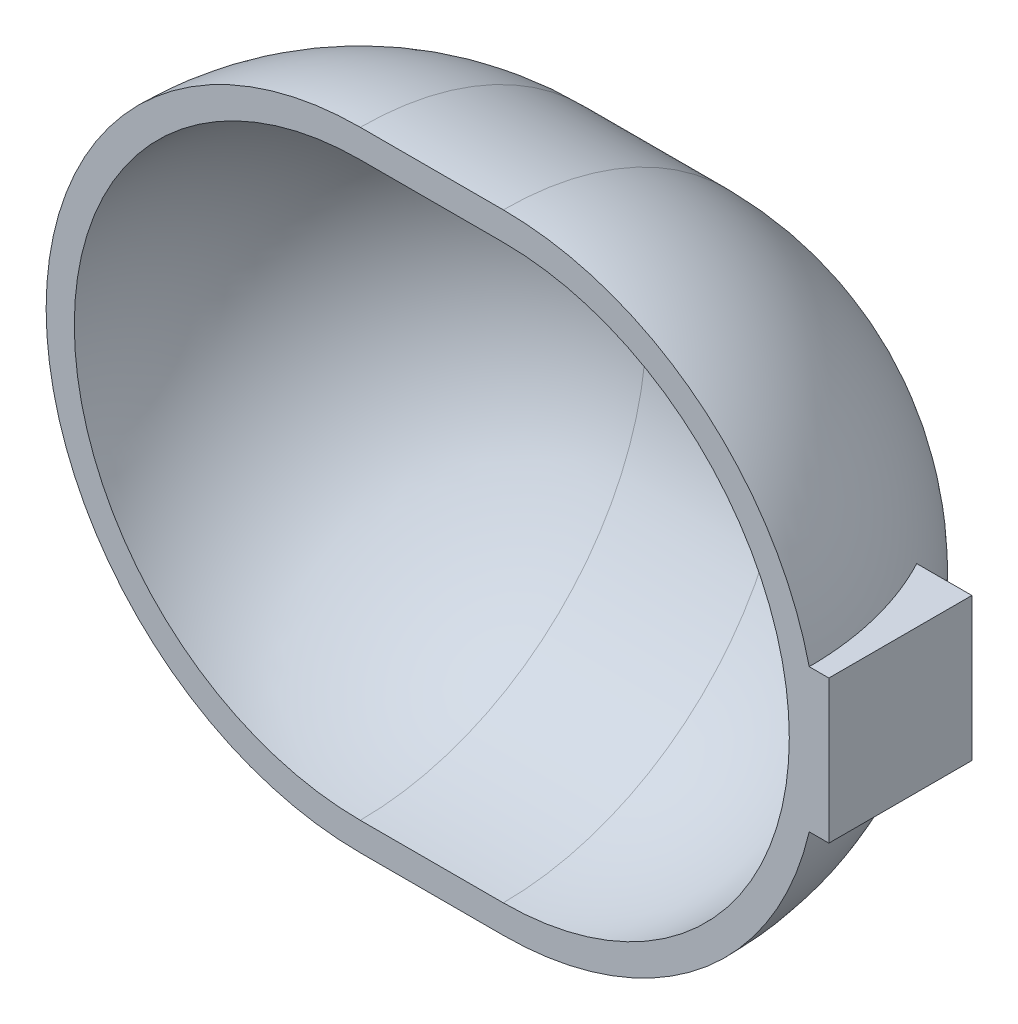
from build123d import *

# Parameters (mm, degrees)
REVOLVE1_ANGLE           = 180
SHELL1_T                 = -50
BOSS_EXTRUDE2_REACH      = 1600.609
BOSS_EXTRUDE2_END_RADIUS = 558
SKETCH5_W                = 254
SKETCH5_H                = 254


with BuildPart() as part:
    # Sketch2 → Revolve1 (revolve)
    with BuildSketch(Plane.XY):
        with BuildLine():
            Line((-279, 0), (279, 0))
            Line((279, 0), (533, 0))
            Line((533, 0), (1091, 0))
            ThreePointArc((1091, 0), (927.565583902, -394.565583902), (533, -558))
            Line((533, -558), (279, -558))
            ThreePointArc((279, -558), (-115.565583902, -394.565583902), (-279, 0))
        make_face()
    revolve(axis=Axis((533, 0, 0), (1, 0, 0)), revolution_arc=REVOLVE1_ANGLE)

    # Shell1
    shell1_openings = [part.faces().sort_by_distance(p)[0] for p in [
        (406, 0, 0),
    ]]
    offset(amount=SHELL1_T, openings=shell1_openings)

    # Boss-Extrude2: up to this sphere (the profile starts outside it)
    boss_extrude2_end = Location((533, 0, 0)) * Sphere(BOSS_EXTRUDE2_END_RADIUS, mode=Mode.PRIVATE)
    # Sketch5 → Boss-Extrude2 (add, up to the surface)
    with BuildSketch(Plane(origin=(1111.26, 0, 0), x_dir=(0, 0, -1), z_dir=(1, 0, 0)), mode=Mode.PRIVATE) as boss_extrude2_sk1:
        with Locations((127, 0)):
            Rectangle(SKETCH5_W, SKETCH5_H)
    boss_extrude2_tool1 = extrude(boss_extrude2_sk1.sketch, amount=-BOSS_EXTRUDE2_REACH, mode=Mode.PRIVATE) - boss_extrude2_end
    add(boss_extrude2_tool1.solids().sort_by_distance((1111.26, 0, -127))[0])


solid = part.part
